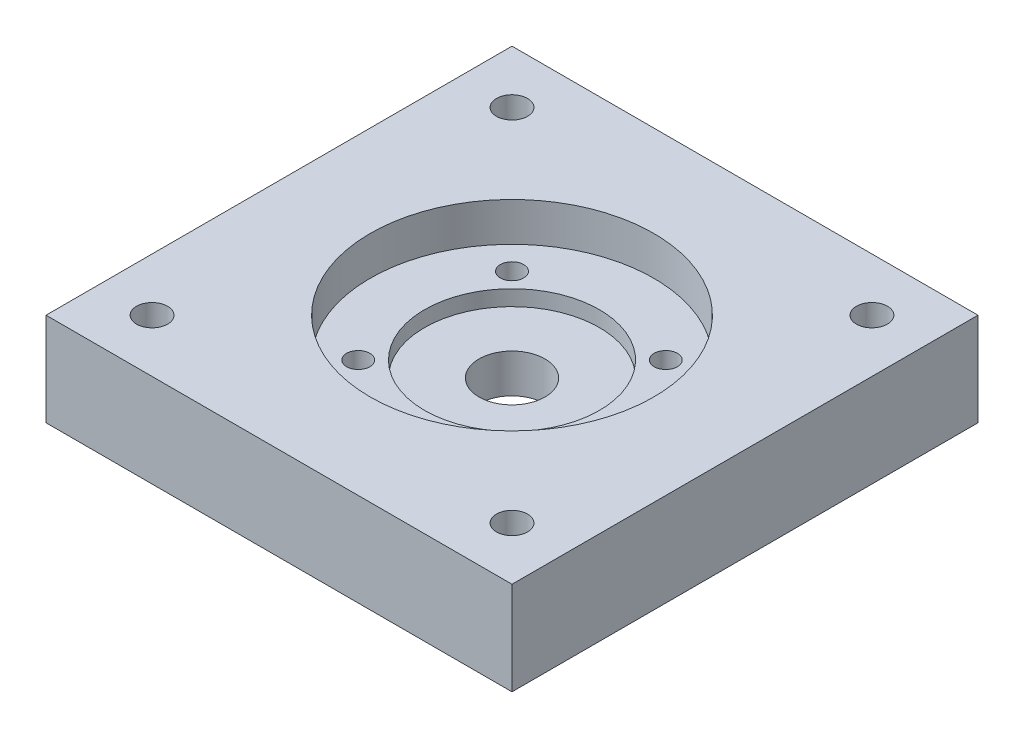
from build123d import *

# Parameters (mm, degrees)
SKETCH_1_W      = 60
SKETCH_1_H      = 60
SKETCH_1_R      = 1.5
SKETCH_1_R_2    = 2
SKETCH_1_R_3    = 4.25
EXTRUDE_1_DEPTH = 5
SKETCH_2_W      = 60
SKETCH_2_H      = 60
SKETCH_2_R      = 2
SKETCH_2_R_2    = 1.5
SKETCH_2_R_3    = 11.25
EXTRUDE_2_DEPTH = 2
SKETCH_3_W      = 60
SKETCH_3_H      = 60
SKETCH_3_R      = 18.25
SKETCH_3_R_2    = 2
EXTRUDE_3_DEPTH = 5


with BuildPart() as part:
    # 草图1 → 凸台-拉伸1 (new body)
    with BuildSketch(Plane(origin=(0, 0, 0), x_dir=(1, 0, 0), z_dir=(0, 1, 0))):
        Rectangle(SKETCH_1_W, SKETCH_1_H)
        with Locations(Location((-9.899494937, 9.899494937, 0), (0, 0, 270))):
            Circle(SKETCH_1_R, mode=Mode.SUBTRACT)
        with Locations(Location((9.899494937, 9.899494937, 0), (0, 0, 270))):
            Circle(SKETCH_1_R, mode=Mode.SUBTRACT)
        with Locations(Location((9.899494937, -9.899494937, 0), (0, 0, 270))):
            Circle(SKETCH_1_R, mode=Mode.SUBTRACT)
        with Locations(Location((-9.899494937, -9.899494937, 0), (0, 0, 270))):
            Circle(SKETCH_1_R, mode=Mode.SUBTRACT)
        with Locations(Location((-23.171320344, 23.171320344, 0), (0, 0, 270))):
            Circle(SKETCH_1_R_2, mode=Mode.SUBTRACT)
        with Locations(Location((23.171320344, 23.171320344, 0), (0, 0, 270))):
            Circle(SKETCH_1_R_2, mode=Mode.SUBTRACT)
        with Locations(Location((-23.171320344, -23.171320344, 0), (0, 0, 270))):
            Circle(SKETCH_1_R_2, mode=Mode.SUBTRACT)
        with Locations(Location((23.171320344, -23.171320344, 0), (0, 0, 270))):
            Circle(SKETCH_1_R_2, mode=Mode.SUBTRACT)
        with Locations(Location((0, 0, 0), (0, 0, 270))):
            Circle(SKETCH_1_R_3, mode=Mode.SUBTRACT)
    extrude(amount=EXTRUDE_1_DEPTH)

    # 草图2 → 凸台-拉伸2 (add)
    with BuildSketch(Plane(origin=(0, 5, 0), x_dir=(1, 0, 0), z_dir=(0, 1, 0))):
        Rectangle(SKETCH_2_W, SKETCH_2_H)
        with Locations(Location((-23.171320344, -23.171320344, 0), (0, 0, 270))):
            Circle(SKETCH_2_R, mode=Mode.SUBTRACT)
        with Locations(Location((23.171320344, 23.171320344, 0), (0, 0, 270))):
            Circle(SKETCH_2_R, mode=Mode.SUBTRACT)
        with Locations(Location((23.171320344, -23.171320344, 0), (0, 0, 270))):
            Circle(SKETCH_2_R, mode=Mode.SUBTRACT)
        with Locations(Location((-23.171320344, 23.171320344, 0), (0, 0, 270))):
            Circle(SKETCH_2_R, mode=Mode.SUBTRACT)
        with Locations(Location((-9.899494937, -9.899494937, 0), (0, 0, 270))):
            Circle(SKETCH_2_R_2, mode=Mode.SUBTRACT)
        with Locations(Location((9.899494937, -9.899494937, 0), (0, 0, 270))):
            Circle(SKETCH_2_R_2, mode=Mode.SUBTRACT)
        with Locations(Location((9.899494937, 9.899494937, 0), (0, 0, 270))):
            Circle(SKETCH_2_R_2, mode=Mode.SUBTRACT)
        with Locations(Location((-9.899494937, 9.899494937, 0), (0, 0, 270))):
            Circle(SKETCH_2_R_2, mode=Mode.SUBTRACT)
        with Locations(Location((0, 0, 0), (0, 0, 270))):
            Circle(SKETCH_2_R_3, mode=Mode.SUBTRACT)
    extrude(amount=EXTRUDE_2_DEPTH)

    # 草图3 → 凸台-拉伸3 (add)
    with BuildSketch(Plane(origin=(0, 7, 0), x_dir=(1, 0, 0), z_dir=(0, 1, 0))):
        Rectangle(SKETCH_3_W, SKETCH_3_H)
        with Locations(Location((0, 0, 0), (0, 0, 270))):
            Circle(SKETCH_3_R, mode=Mode.SUBTRACT)
        with Locations(Location((-23.171320344, -23.171320344, 0), (0, 0, 270))):
            Circle(SKETCH_3_R_2, mode=Mode.SUBTRACT)
        with Locations(Location((23.171320344, 23.171320344, 0), (0, 0, 270))):
            Circle(SKETCH_3_R_2, mode=Mode.SUBTRACT)
        with Locations(Location((23.171320344, -23.171320344, 0), (0, 0, 270))):
            Circle(SKETCH_3_R_2, mode=Mode.SUBTRACT)
        with Locations(Location((-23.171320344, 23.171320344, 0), (0, 0, 270))):
            Circle(SKETCH_3_R_2, mode=Mode.SUBTRACT)
    extrude(amount=EXTRUDE_3_DEPTH)


solid = part.part
